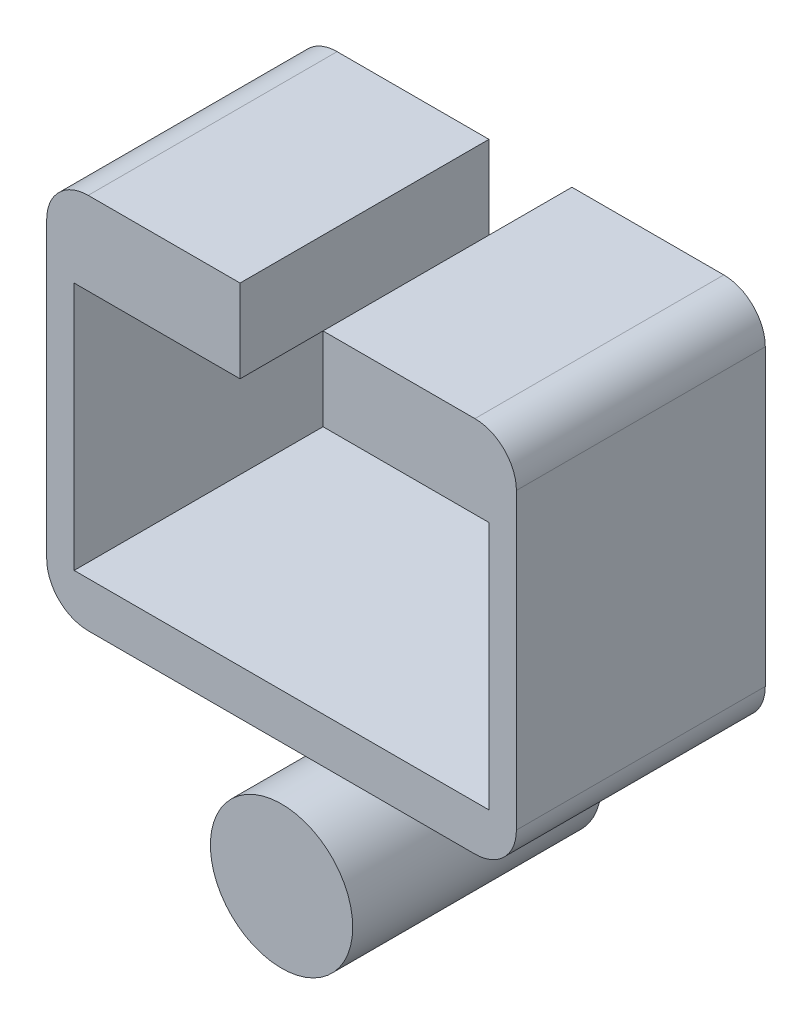
from build123d import *

# Parameters (mm, degrees)
SKETCH1_R           = 10.89504564
BOSS_EXTRUDE1_DEPTH = 38.1
BOSS_EXTRUDE2_DEPTH = 8.89
SKETCH3_W           = 63.5
SKETCH3_H           = 6.927272727
BOSS_EXTRUDE3_DEPTH = 38.1
BOSS_EXTRUDE4_DEPTH = 38.1
FILLET1_R           = 6.35


with BuildPart() as part:
    # Sketch1 → Boss-Extrude1 (new body)
    with BuildSketch(Plane.XY):
        Circle(SKETCH1_R)
    extrude(amount=-BOSS_EXTRUDE1_DEPTH)

    # Sketch2 → Boss-Extrude2 (add)
    with BuildSketch(Plane(origin=(0, 0, -38.1), x_dir=(-1, 0, 0), z_dir=(0, 0, -1))):
        Polygon((-11.176, 0), (11.176, 0), (22.604396494, 19.05), (11.176, 19.05), (-11.176, 19.05), (-22.604396494, 19.05), align=None)
    extrude(amount=-BOSS_EXTRUDE2_DEPTH)

    # Sketch3 → Boss-Extrude3 (add)
    with BuildSketch(Plane(origin=(0, 0, -38.1), x_dir=(-1, 0, 0), z_dir=(0, 0, -1))):
        with Locations((0, 22.513636364)):
            Rectangle(SKETCH3_W, SKETCH3_H)
    extrude(amount=-BOSS_EXTRUDE3_DEPTH)

    # Sketch4 → Boss-Extrude4 (add)
    with BuildSketch(Plane(origin=(0, 0, -38.1), x_dir=(-1, 0, 0), z_dir=(0, 0, -1))):
        Polygon((-31.75, 25.977272727), (-31.75, 64.077272727), (-6.35, 64.077272727), (-6.35, 76.777272727), (-35.948347107, 76.777272727), (-35.948347107, 19.05), (-31.75, 19.05), align=None)
        Polygon((31.75, 25.977272727), (31.75, 64.077272727), (6.35, 64.077272727), (6.35, 76.777272727), (35.948347107, 76.777272727), (35.948347107, 19.05), (31.75, 19.05), align=None)
    extrude(amount=-BOSS_EXTRUDE4_DEPTH)

    # Fillet1
    fillet1_edges = [part.edges().sort_by_distance(p)[0] for p in [
        (35.948347107, 19.05, -19.05),
        (35.948347107, 76.777272727, -19.05),
        (-35.948347107, 76.777272727, -19.05),
        (-35.948347107, 19.05, -19.05),
    ]]
    fillet(fillet1_edges, radius=FILLET1_R)


solid = part.part
